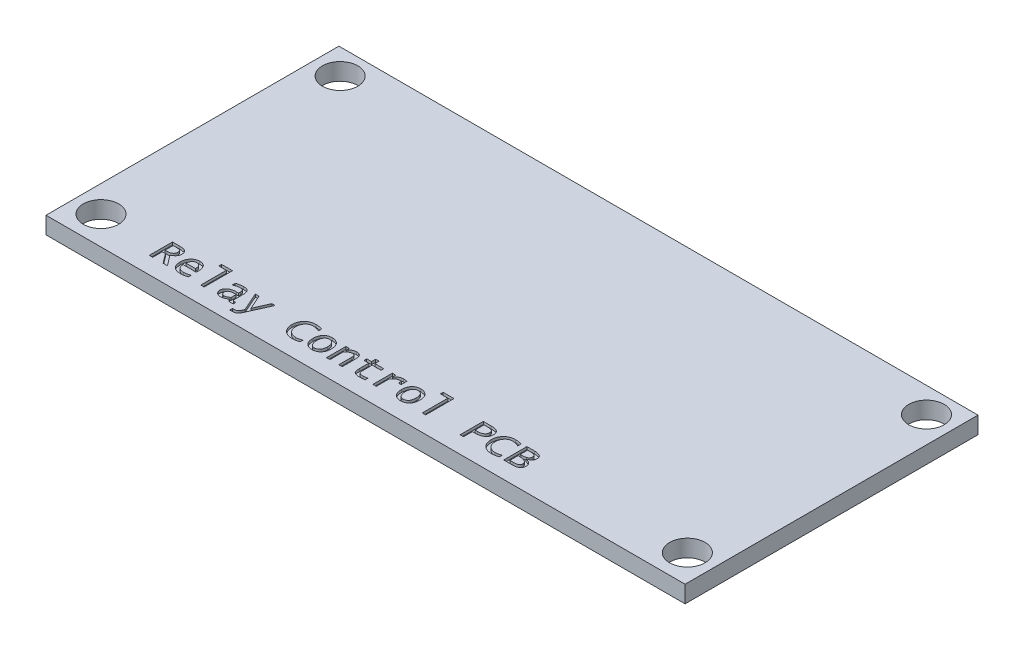
from build123d import *

# Parameters (mm, degrees)
SKETCH1_W           = 60.96
SKETCH1_H           = 27.94
BOSS_EXTRUDE1_DEPTH = 1.6256
SKETCH2_R           = 1.6891
CUT_EXTRUDE1_DEPTH  = 1.6256
CUT_EXTRUDE2_DEPTH  = 0.254


with BuildPart() as part:
    # Sketch1 → Boss-Extrude1 (new body)
    with BuildSketch(Plane(origin=(0, 0, 0), x_dir=(1, 0, 0), z_dir=(0, 1, 0))):
        with Locations((30.48, 13.97)):
            Rectangle(SKETCH1_W, SKETCH1_H)
    extrude(amount=BOSS_EXTRUDE1_DEPTH)

    # Sketch2 → Cut-Extrude1 (cut)
    with BuildSketch(Plane(origin=(0, 1.6256, 0), x_dir=(1, 0, 0), z_dir=(0, 1, 0))):
        with Locations(Location((2.5273, 25.527, 0), (0, 0, 270))):
            Circle(SKETCH2_R)
        with Locations(Location((2.5273, 2.7178, 0), (0, 0, 270))):
            Circle(SKETCH2_R)
        with Locations(Location((58.4581, 25.527, 0), (0, 0, 270))):
            Circle(SKETCH2_R)
        with Locations(Location((58.4581, 2.7178, 0), (0, 0, 270))):
            Circle(SKETCH2_R)
    extrude(amount=-CUT_EXTRUDE1_DEPTH, mode=Mode.SUBTRACT)

    # Sketch3 → Cut-Extrude2 (cut)
    # profile 1 of 15: a face of its own
    with BuildSketch(Plane(origin=(0, 1.6256, 0), x_dir=(1, 0, 0), z_dir=(0, 1, 0))):
        with BuildLine():
            Line((8.241289852, 1.614963424), (8.241289852, 3.825336688))
            Line((8.241289852, 3.825336688), (8.85483096, 3.825336688))
            add(Edge.make_bspline(
                [(8.85483096, 3.825336688), (8.885476334, 3.825151103), (8.944413237, 3.824794188), (9.029104797, 3.821840319), (9.106482902, 3.816623867), (9.176693285, 3.810458116), (9.239612608, 3.80145412), (9.295111287, 3.790061392), (9.343749988, 3.778305924), (9.372649386, 3.766727468), (9.386092549, 3.761341506)],
                knots=[0, 0, 0, 0, 1.367113612, 2.629220428, 3.779705399, 4.826585904, 5.77293059, 6.612770641, 7.354701061, 8, 8, 8, 8], degree=3))
            add(Edge.make_bspline(
                [(9.386092549, 3.761341506), (9.411338501, 3.749837185), (9.460154569, 3.727592205), (9.525477751, 3.683939787), (9.580197997, 3.633462183), (9.626775361, 3.577850331), (9.661183624, 3.514217357), (9.686441123, 3.444802295), (9.701198316, 3.368844169), (9.70307162, 3.316148348), (9.704036865, 3.288996116)],
                knots=[0, 0, 0, 0, 1.093414185, 2.114247111, 3.083486436, 4.023487964, 4.962325756, 5.921685605, 6.929120529, 8, 8, 8, 8], degree=3))
            add(Edge.make_bspline(
                [(9.704036865, 3.288996116), (9.703862196, 3.270015211), (9.703519835, 3.232811728), (9.697348438, 3.178252142), (9.689309719, 3.125804467), (9.676167812, 3.076062448), (9.660854743, 3.028376856), (9.640499601, 2.983707533), (9.618034376, 2.940610952), (9.590492191, 2.900435705), (9.559906016, 2.861140582), (9.523896886, 2.82373871), (9.483679233, 2.786418245), (9.438313646, 2.750088816), (9.388611626, 2.71395262), (9.333874127, 2.67893276), (9.27465449, 2.644353553), (9.232815904, 2.622940787), (9.211375545, 2.611967725)],
                knots=[0, 0, 0, 0, 1.020587864, 2.000401129, 2.951334389, 3.872617743, 4.765590747, 5.642388336, 6.510435801, 7.377000364, 8.259034584, 9.186914164, 10.166727429, 11.209513324, 12.311867936, 13.471627981, 14.704325106, 16, 16, 16, 16], degree=3))
            Line((9.211375545, 2.611967725), (9.965604473, 1.614963424))
            Line((9.965604473, 1.614963424), (9.557762164, 1.614963424))
            Line((9.557762164, 1.614963424), (8.869052112, 2.525117121))
            Line((8.869052112, 2.525117121), (8.566344744, 2.525117121))
            Line((8.566344744, 2.525117121), (8.566344744, 1.614963424))
            Line((8.566344744, 1.614963424), (8.241289852, 1.614963424))
        make_face()
        with BuildLine():
            Line((8.566344744, 2.785161034), (8.747156527, 2.785161034))
            add(Edge.make_bspline(
                [(8.747156527, 2.785161034), (8.769517546, 2.785566587), (8.813294528, 2.786360552), (8.877056054, 2.792086562), (8.937629555, 2.800804064), (8.994153947, 2.814858102), (9.047552949, 2.831275676), (9.096895089, 2.852338759), (9.143039203, 2.876598844), (9.185007773, 2.905182253), (9.223166286, 2.93624288), (9.25610619, 2.970825041), (9.284138922, 3.00792581), (9.307196779, 3.047597826), (9.324577925, 3.09006253), (9.337359847, 3.134995847), (9.345053818, 3.182751267), (9.345997481, 3.215492221), (9.346476484, 3.23211151)],
                knots=[0, 0, 0, 0, 1.276996505, 2.500022648, 3.654255475, 4.768296067, 5.823365809, 6.841681044, 7.82799832, 8.796184009, 9.737138299, 10.633094166, 11.516913919, 12.387677223, 13.246057197, 14.130670065, 15.051129245, 16, 16, 16, 16], degree=3))
            add(Edge.make_bspline(
                [(9.346476484, 3.23211151), (9.346063532, 3.247530942), (9.345271005, 3.277123538), (9.339915616, 3.31960311), (9.329949719, 3.358145045), (9.317346122, 3.393357682), (9.299377721, 3.424287348), (9.278773097, 3.452139799), (9.253518443, 3.475666452), (9.224068902, 3.495368359), (9.189833817, 3.512435003), (9.149412584, 3.526201083), (9.102897189, 3.538350683), (9.049974167, 3.548461366), (8.990569963, 3.55573425), (8.92483426, 3.56124215), (8.85284052, 3.564908554), (8.802691524, 3.565161332), (8.776614627, 3.565292774)],
                knots=[0, 0, 0, 0, 0.972380494, 1.866168869, 2.692100406, 3.479246527, 4.215447888, 4.939238499, 5.656703529, 6.379154588, 7.1668796, 8.061623728, 9.066283506, 10.196846312, 11.456066542, 12.838163819, 14.355881806, 16, 16, 16, 16], degree=3))
            Line((8.776614627, 3.565292774), (8.566344744, 3.565292774))
            Line((8.566344744, 3.565292774), (8.566344744, 2.785161034))
        make_face(mode=Mode.SUBTRACT)
    # profile 2 of 15: a face of its own
    with BuildSketch(Plane(origin=(0, 1.6256, 0), x_dir=(1, 0, 0), z_dir=(0, 1, 0))):
        with BuildLine():
            add(Edge.make_bspline(
                [(11.88190464, 1.701814028), (11.853353113, 1.692314371), (11.797041108, 1.673578256), (11.712729382, 1.649118691), (11.629975414, 1.628917979), (11.549177206, 1.612118397), (11.470279036, 1.598608964), (11.393122768, 1.589686247), (11.317721467, 1.583761187), (11.268035599, 1.58288903), (11.243476516, 1.582457935)],
                knots=[0, 0, 0, 0, 1.106937951, 2.18320703, 3.228556918, 4.239975729, 5.218864236, 6.172194916, 7.096539541, 8, 8, 8, 8], degree=3))
            add(Edge.make_bspline(
                [(11.243476516, 1.582457935), (11.20501839, 1.583284852), (11.130136114, 1.584894951), (11.021070644, 1.596024037), (10.918784995, 1.614859844), (10.823644202, 1.642854464), (10.734849732, 1.676705001), (10.653474564, 1.719958898), (10.578792392, 1.770424392), (10.511055684, 1.828439915), (10.450597879, 1.893711944), (10.398946066, 1.966437545), (10.354003514, 2.045055047), (10.318813053, 2.131146964), (10.29088382, 2.22350306), (10.270494597, 2.322390818), (10.258981657, 2.428003438), (10.257428354, 2.500540857), (10.256630181, 2.537814577)],
                knots=[0, 0, 0, 0, 1.179111467, 2.295861945, 3.357756168, 4.363169365, 5.332947048, 6.266436329, 7.182147119, 8.091479248, 8.995208024, 9.902804883, 10.820984298, 11.765764665, 12.747774982, 13.776032362, 14.857202978, 16, 16, 16, 16], degree=3))
            add(Edge.make_bspline(
                [(10.256630181, 2.537814577), (10.257474376, 2.573225538), (10.259130691, 2.642702033), (10.270243148, 2.744518292), (10.289453308, 2.841620601), (10.317069874, 2.933633507), (10.351524634, 3.021005844), (10.393921092, 3.103451574), (10.444579349, 3.180815471), (10.501955086, 3.253197657), (10.565964418, 3.318277552), (10.633764226, 3.376520918), (10.707223094, 3.423978008), (10.783683944, 3.464504842), (10.865291305, 3.494665902), (10.950561996, 3.517382238), (11.040451182, 3.529988309), (11.101566815, 3.531841556), (11.132754694, 3.532787285)],
                knots=[0, 0, 0, 0, 1.144924092, 2.24634722, 3.307023249, 4.340990177, 5.348357882, 6.339910119, 7.332896818, 8.333998253, 9.321113179, 10.280642896, 11.217417477, 12.142912282, 13.073202805, 14.023869222, 14.991561987, 16, 16, 16, 16], degree=3))
            add(Edge.make_bspline(
                [(11.132754694, 3.532787285), (11.163773086, 3.532193598), (11.223993414, 3.531040991), (11.311058494, 3.519627678), (11.391899876, 3.501474594), (11.466589517, 3.476316544), (11.534856978, 3.443009092), (11.596701942, 3.40223568), (11.652058095, 3.35392917), (11.701305759, 3.298538311), (11.744379129, 3.235165252), (11.781121275, 3.163699498), (11.812852891, 3.084525627), (11.837792759, 2.99692299), (11.858139314, 2.901602689), (11.872151306, 2.797873112), (11.880005696, 2.686244048), (11.881258375, 2.609102217), (11.88190464, 2.56930427)],
                knots=[0, 0, 0, 0, 1.062643871, 2.063058638, 3.003358825, 3.898834045, 4.757807989, 5.599498343, 6.430297586, 7.268761563, 8.133030449, 9.049191006, 10.017869939, 11.051653124, 12.166951628, 13.35602215, 14.635955523, 16, 16, 16, 16], degree=3))
            Line((11.88190464, 2.56930427), (11.88190464, 2.460106142))
            Line((11.88190464, 2.460106142), (10.614190562, 2.460106142))
            add(Edge.make_bspline(
                [(10.614190562, 2.460106142), (10.616193485, 2.435177158), (10.620094053, 2.386629514), (10.631880046, 2.316504323), (10.647922115, 2.250974931), (10.669247506, 2.190434222), (10.695275263, 2.13462839), (10.725706834, 2.083579242), (10.761074529, 2.037307002), (10.801294467, 1.996218724), (10.846020193, 1.959645074), (10.895449701, 1.928109495), (10.949891569, 1.901648334), (11.008894316, 1.879767614), (11.072607566, 1.863334962), (11.140811711, 1.850922077), (11.213707434, 1.844041789), (11.263948201, 1.843023628), (11.289695259, 1.842501848)],
                knots=[0, 0, 0, 0, 1.158383093, 2.255878882, 3.290898553, 4.280849978, 5.224885718, 6.139722503, 7.029356833, 7.916948214, 8.797858555, 9.700949034, 10.627150686, 11.597640165, 12.611818582, 13.672009313, 14.806966626, 16, 16, 16, 16], degree=3))
            add(Edge.make_bspline(
                [(11.289695259, 1.842501848), (11.312394203, 1.842907266), (11.358547438, 1.843731592), (11.42857162, 1.850118473), (11.50028024, 1.860266234), (11.573483982, 1.874621454), (11.648467331, 1.892861027), (11.724861808, 1.916056), (11.803296165, 1.94218964), (11.855411141, 1.962636969), (11.88190464, 1.973031703)],
                knots=[0, 0, 0, 0, 0.892829391, 1.815369226, 2.763820351, 3.740813249, 4.748754968, 5.798112898, 6.88063477, 8, 8, 8, 8], degree=3))
            Line((11.88190464, 1.973031703), (11.88190464, 1.701814028))
        make_face()
        with BuildLine():
            Line((10.624348527, 2.720150056), (11.524344259, 2.720150056))
            Line((11.524344259, 2.720150056), (11.524344259, 2.768400391))
            add(Edge.make_bspline(
                [(11.524344259, 2.768400391), (11.524118105, 2.788729369), (11.523678223, 2.828270278), (11.518401263, 2.885416535), (11.510565461, 2.938792098), (11.498682754, 2.988126658), (11.484441627, 3.033933155), (11.465772513, 3.075439231), (11.444587507, 3.113192825), (11.420091081, 3.147137767), (11.39195126, 3.17691727), (11.3600883, 3.202301214), (11.325465496, 3.224357149), (11.287423996, 3.242265653), (11.245978193, 3.256003514), (11.201135344, 3.265304682), (11.153252662, 3.271704188), (11.120248833, 3.272390732), (11.103296594, 3.272743372)],
                knots=[0, 0, 0, 0, 1.29732314, 2.523360331, 3.660579791, 4.737989141, 5.759926536, 6.717913547, 7.63751686, 8.519516399, 9.383384998, 10.244205955, 11.113734908, 11.998445146, 12.92121842, 13.894207024, 14.918370803, 16, 16, 16, 16], degree=3))
            add(Edge.make_bspline(
                [(11.103296594, 3.272743372), (11.086841716, 3.272465974), (11.0544463, 3.271919849), (11.007239375, 3.264259461), (10.962056446, 3.253575449), (10.919736412, 3.23678346), (10.879354982, 3.216629647), (10.841336446, 3.191571008), (10.806444636, 3.161154546), (10.773319744, 3.127280527), (10.743152437, 3.089088321), (10.717181377, 3.046554826), (10.692768878, 3.001281526), (10.672741456, 2.951978653), (10.656058614, 2.899061831), (10.641701914, 2.842841701), (10.631146243, 2.782711129), (10.626651275, 2.741342812), (10.624348527, 2.720150056)],
                knots=[0, 0, 0, 0, 0.971093896, 1.911833578, 2.819168626, 3.708966016, 4.594706045, 5.482477073, 6.39058371, 7.324330932, 8.278849472, 9.258559982, 10.265318396, 11.314847487, 12.396720664, 13.541809176, 14.740682675, 16, 16, 16, 16], degree=3))
        make_face(mode=Mode.SUBTRACT)
    # profile 3 of 15: a face of its own
    with BuildSketch(Plane(origin=(0, 1.6256, 0), x_dir=(1, 0, 0), z_dir=(0, 1, 0))):
        Polygon((13.149618718, 1.614963424), (13.149618718, 4.052875112), (12.434497956, 4.052875112), (12.434497956, 4.312919025), (13.474673609, 4.312919025), (13.474673609, 1.614963424), align=None)
    # profile 4 of 15: a face of its own
    with BuildSketch(Plane(origin=(0, 1.6256, 0), x_dir=(1, 0, 0), z_dir=(0, 1, 0))):
        with BuildLine():
            add(Edge.make_bspline(
                [(15.673365213, 1.839454459), (15.6482865, 1.818888937), (15.599448825, 1.778840143), (15.522628447, 1.727148247), (15.446537925, 1.682457377), (15.369958022, 1.646378317), (15.293871975, 1.617410223), (15.217357703, 1.597719388), (15.141186645, 1.584831242), (15.090178868, 1.583244306), (15.064903088, 1.582457935)],
                knots=[0, 0, 0, 0, 1.153890534, 2.247058269, 3.292071886, 4.29219234, 5.257104076, 6.185296689, 7.100763748, 8, 8, 8, 8], degree=3))
            add(Edge.make_bspline(
                [(15.064903088, 1.582457935), (15.044234533, 1.583025956), (15.003639243, 1.584141611), (14.944094654, 1.590530815), (14.887358455, 1.60235879), (14.833542111, 1.618653121), (14.782147521, 1.638907109), (14.733876163, 1.664415058), (14.688370729, 1.694650522), (14.646007114, 1.728966492), (14.607399384, 1.766650069), (14.574486334, 1.807794495), (14.545264958, 1.850448431), (14.522886246, 1.896596174), (14.504009066, 1.944464462), (14.491670781, 1.995051284), (14.483678038, 2.047944264), (14.482795467, 2.084061335), (14.482343774, 2.102545762)],
                knots=[0, 0, 0, 0, 1.135034291, 2.229330773, 3.283077622, 4.312349151, 5.313532734, 6.311474483, 7.304076705, 8.308706713, 9.301265407, 10.259450024, 11.197907141, 12.133274565, 13.068965271, 14.018134357, 14.985697108, 16, 16, 16, 16], degree=3))
            add(Edge.make_bspline(
                [(14.482343774, 2.102545762), (14.483139361, 2.126462083), (14.484695312, 2.173235852), (14.496504571, 2.24179118), (14.517066237, 2.306524506), (14.545079802, 2.367836153), (14.580991981, 2.425611786), (14.625926481, 2.478858905), (14.677744974, 2.529602216), (14.73808435, 2.575299385), (14.804046031, 2.617528269), (14.876337369, 2.653328875), (14.953062073, 2.684699909), (15.035371712, 2.709114171), (15.122304448, 2.729313087), (15.214595179, 2.742383032), (15.311723712, 2.751595445), (15.378252809, 2.75229664), (15.412305503, 2.752655545)],
                knots=[0, 0, 0, 0, 0.905207686, 1.770338063, 2.623778729, 3.469870763, 4.316423955, 5.190436419, 6.101525076, 7.056642134, 8.050647555, 9.062512752, 10.106353745, 11.185035099, 12.309221938, 13.48219702, 14.711271009, 16, 16, 16, 16], degree=3))
            Line((15.412305503, 2.752655545), (15.620035895, 2.752655545))
            Line((15.620035895, 2.752655545), (15.620035895, 2.910611906))
            add(Edge.make_bspline(
                [(15.620035895, 2.910611906), (15.619732243, 2.926367179), (15.619146729, 2.956747138), (15.615005093, 3.000515355), (15.608712624, 3.04085983), (15.598981147, 3.077546841), (15.586883649, 3.11078322), (15.572064285, 3.140715529), (15.554447862, 3.167141284), (15.533682121, 3.190034604), (15.509694436, 3.209521155), (15.482817503, 3.2270004), (15.451901806, 3.241059931), (15.417698662, 3.252734821), (15.379775562, 3.261799758), (15.338353652, 3.2683773), (15.29334, 3.271662396), (15.262310441, 3.272374284), (15.246222769, 3.272743372)],
                knots=[0, 0, 0, 0, 1.248532718, 2.407471645, 3.481758227, 4.480934039, 5.410664349, 6.280774303, 7.12184432, 7.919742115, 8.720343129, 9.565257569, 10.453694103, 11.404203611, 12.426095927, 13.540121796, 14.724644734, 16, 16, 16, 16], degree=3))
            add(Edge.make_bspline(
                [(15.246222769, 3.272743372), (15.221825757, 3.272244372), (15.1729145, 3.271243974), (15.099053926, 3.263371215), (15.024853526, 3.249959439), (14.949585698, 3.232308882), (14.87426972, 3.208700542), (14.797915131, 3.180579615), (14.721010116, 3.147334898), (14.670463217, 3.121343719), (14.64487122, 3.108184333)],
                knots=[0, 0, 0, 0, 0.929836159, 1.864140347, 2.82750036, 3.802654558, 4.808977315, 5.833936312, 6.903317557, 8, 8, 8, 8], degree=3))
            Line((14.64487122, 3.108184333), (14.64487122, 3.401241634))
            add(Edge.make_bspline(
                [(14.64487122, 3.401241634), (14.674063836, 3.411857924), (14.731547663, 3.432762696), (14.818210439, 3.458705236), (14.90301968, 3.482181326), (14.986916056, 3.499992378), (15.06912957, 3.51522123), (15.150208586, 3.525172004), (15.229865358, 3.531586161), (15.282610191, 3.532389839), (15.308694256, 3.532787285)],
                knots=[0, 0, 0, 0, 1.095658522, 2.157485397, 3.190532041, 4.199239102, 5.182224591, 6.139393651, 7.079868589, 8, 8, 8, 8], degree=3))
            add(Edge.make_bspline(
                [(15.308694256, 3.532787285), (15.336641525, 3.532459528), (15.390589271, 3.531826844), (15.468326031, 3.525268898), (15.539595825, 3.51415232), (15.604620794, 3.499178974), (15.663154919, 3.479440216), (15.715607199, 3.455582174), (15.761818417, 3.42723213), (15.801596888, 3.393441334), (15.836521585, 3.354846783), (15.865213122, 3.309312101), (15.890390032, 3.258172085), (15.91038987, 3.200455382), (15.926155459, 3.136527395), (15.936819, 3.066309127), (15.944356473, 2.989837606), (15.944839651, 2.936704598), (15.945090787, 2.909088212)],
                knots=[0, 0, 0, 0, 1.288059159, 2.486392846, 3.592378245, 4.610779344, 5.55845866, 6.434921453, 7.262158836, 8.04855768, 8.833406052, 9.651649244, 10.520715006, 11.456201581, 12.461268821, 13.551837875, 14.727544453, 16, 16, 16, 16], degree=3))
            Line((15.945090787, 2.909088212), (15.945090787, 2.131495963))
            add(Edge.make_bspline(
                [(15.945090787, 2.131495963), (15.945519135, 2.10574551), (15.946301754, 2.058697814), (15.953107322, 1.994508405), (15.964040397, 1.94345835), (15.979814433, 1.903294495), (16.00520026, 1.874670489), (16.038490667, 1.8555933), (16.079589396, 1.843838194), (16.109730435, 1.842968488), (16.12590257, 1.842501848)],
                knots=[0, 0, 0, 0, 1.561127975, 2.852278997, 3.905582773, 4.723763991, 5.436425983, 6.177572276, 7.022178762, 8, 8, 8, 8], degree=3))
            add(Edge.make_bspline(
                [(16.12590257, 1.842501848), (16.132517365, 1.842711195), (16.147684134, 1.843191197), (16.172833403, 1.847420639), (16.203600454, 1.852136151), (16.225646869, 1.857080596), (16.237640189, 1.859770389)],
                knots=[0, 0, 0, 0, 0.700679122, 1.606555997, 2.697958932, 4, 4, 4, 4], degree=3))
            Line((16.237640189, 1.859770389), (16.270145678, 1.641882032))
            add(Edge.make_bspline(
                [(16.270145678, 1.641882032), (16.243649938, 1.632964297), (16.194376964, 1.616380374), (16.124782276, 1.597446546), (16.0652237, 1.585037562), (16.028599869, 1.583258033), (16.012133358, 1.582457935)],
                knots=[0, 0, 0, 0, 1.261837553, 2.346584317, 3.256604634, 4, 4, 4, 4], degree=3))
            add(Edge.make_bspline(
                [(16.012133358, 1.582457935), (15.992086653, 1.583179865), (15.953122091, 1.584583073), (15.897426703, 1.597087272), (15.846340298, 1.616933978), (15.800878585, 1.645767942), (15.760444796, 1.682529768), (15.726053508, 1.727598957), (15.695268915, 1.77983152), (15.68087081, 1.81902386), (15.673365213, 1.839454459)],
                knots=[0, 0, 0, 0, 1.048318431, 2.037605065, 2.972505624, 3.904544578, 4.839445137, 5.818192706, 6.862644383, 8, 8, 8, 8], degree=3))
        make_face()
        with BuildLine():
            Line((15.620035895, 2.05023224), (15.620035895, 2.525117121))
            Line((15.620035895, 2.525117121), (15.520995732, 2.525117121))
            add(Edge.make_bspline(
                [(15.520995732, 2.525117121), (15.493560273, 2.524863762), (15.440342238, 2.524372309), (15.36311032, 2.519480072), (15.290970311, 2.512969768), (15.224414927, 2.502032313), (15.16308497, 2.489103225), (15.107043274, 2.472869301), (15.056093154, 2.453822829), (15.010760956, 2.431385348), (14.970350642, 2.406535882), (14.93585932, 2.37783585), (14.905803977, 2.346868463), (14.881776152, 2.312275939), (14.862620063, 2.274951543), (14.849623106, 2.23426613), (14.841136766, 2.190934748), (14.84032064, 2.160995659), (14.839904155, 2.145717114)],
                knots=[0, 0, 0, 0, 1.50625563, 2.92176505, 4.248237091, 5.481598122, 6.623035994, 7.688018134, 8.682502909, 9.605460173, 10.461778299, 11.280695653, 12.063186274, 12.824006038, 13.584825801, 14.35798353, 15.16204461, 16, 16, 16, 16], degree=3))
            add(Edge.make_bspline(
                [(14.839904155, 2.145717114), (14.84093115, 2.123940761), (14.842912375, 2.081930975), (14.859484985, 2.022093479), (14.887531617, 1.969200547), (14.925808782, 1.923612851), (14.973654483, 1.887293317), (15.029322555, 1.861046765), (15.09212015, 1.84499857), (15.136418272, 1.843354008), (15.159372165, 1.842501848)],
                knots=[0, 0, 0, 0, 1.052589828, 2.030600508, 2.976191915, 3.92977149, 4.888406153, 5.859563425, 6.890893128, 8, 8, 8, 8], degree=3))
            add(Edge.make_bspline(
                [(15.159372165, 1.842501848), (15.177706966, 1.843011685), (15.214826289, 1.844043864), (15.270579124, 1.85512381), (15.327021016, 1.871329031), (15.384478581, 1.893835268), (15.442228364, 1.923765474), (15.501348311, 1.95944257), (15.561384951, 2.001556451), (15.600110772, 2.033695915), (15.620035895, 2.05023224)],
                knots=[0, 0, 0, 0, 0.852214443, 1.725332208, 2.635486976, 3.583556618, 4.591294557, 5.65873827, 6.795379228, 8, 8, 8, 8], degree=3))
        make_face(mode=Mode.SUBTRACT)
    # profile 5 of 15: a face of its own
    with BuildSketch(Plane(origin=(0, 1.6256, 0), x_dir=(1, 0, 0), z_dir=(0, 1, 0))):
        with BuildLine():
            Line((16.59520057, 0.932348151), (16.59520057, 1.192392065))
            Line((16.59520057, 1.192392065), (16.733348899, 1.192392065))
            add(Edge.make_bspline(
                [(16.733348899, 1.192392065), (16.748925581, 1.192636528), (16.778915236, 1.193107192), (16.822365767, 1.195306705), (16.862342896, 1.200553743), (16.89911349, 1.207175724), (16.932943644, 1.21491058), (16.963211417, 1.225759402), (16.990512749, 1.237674956), (17.014731291, 1.252612693), (17.037746721, 1.270271903), (17.060050906, 1.29256786), (17.082774756, 1.318894824), (17.105677869, 1.349726045), (17.128926516, 1.384632952), (17.15226049, 1.424077543), (17.176248819, 1.467649082), (17.191281198, 1.498748868), (17.199091611, 1.514907465)],
                knots=[0, 0, 0, 0, 1.215822254, 2.340812267, 3.392915948, 4.359586048, 5.256858456, 6.096751702, 6.865455452, 7.576961609, 8.311643621, 9.12449773, 10.033080132, 11.024005455, 12.119673954, 13.304740363, 14.59961686, 16, 16, 16, 16], degree=3))
            Line((17.199091611, 1.514907465), (17.283402724, 1.690640266))
            Line((17.283402724, 1.690640266), (16.497684103, 3.467776307))
            Line((16.497684103, 3.467776307), (16.85321289, 3.467776307))
            Line((16.85321289, 3.467776307), (17.461167118, 2.092387796))
            Line((17.461167118, 2.092387796), (18.077755615, 3.467776307))
            Line((18.077755615, 3.467776307), (18.383002475, 3.467776307))
            Line((18.383002475, 3.467776307), (17.440343289, 1.370664357))
            add(Edge.make_bspline(
                [(17.440343289, 1.370664357), (17.431046573, 1.350934859), (17.412965669, 1.312563547), (17.38350254, 1.258016046), (17.352630885, 1.208318523), (17.320417351, 1.163032598), (17.286653716, 1.122576398), (17.251216175, 1.08668859), (17.214953368, 1.055063325), (17.176519501, 1.028267144), (17.13582247, 1.004682229), (17.09081506, 0.986021891), (17.042372367, 0.968674694), (16.989461466, 0.956141212), (16.932914068, 0.945200682), (16.87216623, 0.937776599), (16.807405316, 0.933168001), (16.762815279, 0.932626042), (16.739951577, 0.932348151)],
                knots=[0, 0, 0, 0, 1.175621874, 2.286431924, 3.33997403, 4.327736134, 5.280120566, 6.177196756, 7.044386362, 7.869844285, 8.699630067, 9.574470369, 10.492337385, 11.470736604, 12.501781695, 13.596464551, 14.767578506, 16, 16, 16, 16], degree=3))
            Line((16.739951577, 0.932348151), (16.59520057, 0.932348151))
        make_face()
    # profile 6 of 15: a face of its own
    with BuildSketch(Plane(origin=(0, 1.6256, 0), x_dir=(1, 0, 0), z_dir=(0, 1, 0))):
        with BuildLine():
            add(Edge.make_bspline(
                [(22.576210578, 1.664737454), (22.548003193, 1.655549582), (22.49221892, 1.637379207), (22.408309735, 1.614162804), (22.325869598, 1.594201073), (22.244455968, 1.578538646), (22.164533164, 1.565761258), (22.085596553, 1.556396515), (22.007936378, 1.551436341), (21.956580621, 1.550443507), (21.931179777, 1.549952446)],
                knots=[0, 0, 0, 0, 1.081965916, 2.139747483, 3.174733324, 4.175094905, 5.162931694, 6.126536825, 7.073374689, 8, 8, 8, 8], degree=3))
            add(Edge.make_bspline(
                [(21.931179777, 1.549952446), (21.888131986, 1.550910224), (21.803976837, 1.552782608), (21.680969458, 1.567934846), (21.564197534, 1.591864622), (21.454002449, 1.6266176), (21.35006328, 1.670911143), (21.252706195, 1.725470125), (21.161784534, 1.789993987), (21.077662435, 1.863286831), (21.002125781, 1.944908463), (20.936125631, 2.033463079), (20.879839776, 2.128110828), (20.834893768, 2.229433772), (20.798656804, 2.336219536), (20.774410942, 2.449754794), (20.758629279, 2.569198354), (20.756823465, 2.651023656), (20.755903184, 2.692723549)],
                knots=[0, 0, 0, 0, 1.118931216, 2.187425234, 3.217350199, 4.21414867, 5.186325687, 6.15001506, 7.109977582, 8.080189445, 9.045807082, 9.995725862, 10.946928827, 11.902491192, 12.872703055, 13.87343005, 14.916255286, 16, 16, 16, 16], degree=3))
            add(Edge.make_bspline(
                [(20.755903184, 2.692723549), (20.756825193, 2.735097831), (20.758631193, 2.818099154), (20.77432977, 2.939263815), (20.799015289, 3.054448105), (20.833984423, 3.163456552), (20.879440652, 3.266296023), (20.935171055, 3.362676372), (21.000508605, 3.453206073), (21.075561945, 3.536635719), (21.158495639, 3.61217239), (21.248376259, 3.678072155), (21.344495934, 3.733965937), (21.447085171, 3.778868022), (21.555399563, 3.81509298), (21.670120854, 3.839227701), (21.790721231, 3.85517719), (21.873225615, 3.856940213), (21.915434931, 3.857842177)],
                knots=[0, 0, 0, 0, 1.0995232, 2.153709225, 3.165665306, 4.153781185, 5.119809112, 6.078613098, 7.038534319, 8.012595404, 8.986339211, 9.945294251, 10.900293905, 11.866321831, 12.847445323, 13.859401405, 14.904867853, 16, 16, 16, 16], degree=3))
            add(Edge.make_bspline(
                [(21.915434931, 3.857842177), (21.965263751, 3.856442076), (22.066945799, 3.85358499), (22.221969429, 3.833844409), (22.38209864, 3.802142604), (22.489049455, 3.771443135), (22.543705089, 3.755754625)],
                knots=[0, 0, 0, 0, 0.936097553, 1.910226207, 2.932051975, 4, 4, 4, 4], degree=3))
            Line((22.543705089, 3.755754625), (22.543705089, 3.441873495))
            add(Edge.make_bspline(
                [(22.543705089, 3.441873495), (22.51555626, 3.454364932), (22.460124742, 3.478963443), (22.37617838, 3.510086207), (22.293973424, 3.537364439), (22.213022206, 3.559076325), (22.133768264, 3.576621969), (22.05575139, 3.588864894), (21.979062038, 3.596148216), (21.928316509, 3.597252624), (21.903245373, 3.597798264)],
                knots=[0, 0, 0, 0, 1.112675182, 2.191113334, 3.233975947, 4.241734523, 5.218597299, 6.166145841, 7.093973251, 8, 8, 8, 8], degree=3))
            add(Edge.make_bspline(
                [(21.903245373, 3.597798264), (21.875102353, 3.597003974), (21.81992166, 3.595446591), (21.739002017, 3.583592284), (21.661951704, 3.563630237), (21.588342036, 3.536335004), (21.518962464, 3.500416671), (21.453357097, 3.456870097), (21.391811896, 3.4053246), (21.334737542, 3.346401305), (21.282513038, 3.281860085), (21.237270845, 3.211971384), (21.198814086, 3.13787748), (21.167988525, 3.059285013), (21.143531213, 2.976530582), (21.125648438, 2.889587032), (21.115566653, 2.798097673), (21.114174695, 2.735749855), (21.113463565, 2.703897311)],
                knots=[0, 0, 0, 0, 1.011028754, 1.982348333, 2.931097292, 3.866687365, 4.797200433, 5.731939655, 6.690777018, 7.675943026, 8.675430251, 9.669291956, 10.662408638, 11.670082472, 12.697955605, 13.759796357, 14.855514333, 16, 16, 16, 16], degree=3))
            add(Edge.make_bspline(
                [(21.113463565, 2.703897311), (21.114262956, 2.671864911), (21.115833366, 2.608936965), (21.127624404, 2.516738885), (21.147313336, 2.429125109), (21.17514776, 2.34604003), (21.209873407, 2.26709863), (21.253468042, 2.192893329), (21.305282122, 2.123603325), (21.363719467, 2.058897852), (21.428688744, 2.000427057), (21.499020191, 1.949688884), (21.573482025, 1.905983947), (21.652827246, 1.870983527), (21.73630854, 1.843376581), (21.824497763, 1.824247119), (21.916970865, 1.812336301), (21.980239916, 1.810785638), (22.0124435, 1.809996359)],
                knots=[0, 0, 0, 0, 1.080131531, 2.121928359, 3.128955641, 4.10398994, 5.072751268, 6.032450968, 6.999713538, 7.986051033, 8.96856335, 9.941656347, 10.906286262, 11.87504759, 12.860922218, 13.866702285, 14.914163681, 16, 16, 16, 16], degree=3))
            add(Edge.make_bspline(
                [(22.0124435, 1.809996359), (22.032770053, 1.810451761), (22.074508774, 1.811386886), (22.138450538, 1.817136013), (22.205079409, 1.826821922), (22.274143735, 1.840796311), (22.346044629, 1.858013177), (22.420476729, 1.879577485), (22.497860206, 1.904245324), (22.549706386, 1.923547968), (22.576210578, 1.933415638)],
                knots=[0, 0, 0, 0, 0.840932187, 1.726777439, 2.653885648, 3.62500311, 4.640855233, 5.711624304, 6.830163618, 8, 8, 8, 8], degree=3))
            Line((22.576210578, 1.933415638), (22.576210578, 1.664737454))
        make_face()
    # profile 7 of 15: a face of its own
    with BuildSketch(Plane(origin=(0, 1.6256, 0), x_dir=(1, 0, 0), z_dir=(0, 1, 0))):
        with BuildLine():
            add(Edge.make_bspline(
                [(23.778913678, 1.582457935), (23.745691322, 1.583199899), (23.680706704, 1.58465122), (23.585987942, 1.597100057), (23.496730717, 1.617090211), (23.413047081, 1.645951932), (23.334630417, 1.682267398), (23.261897906, 1.727397988), (23.194918461, 1.78074713), (23.133531466, 1.841644029), (23.078427711, 1.909794839), (23.031337916, 1.984928058), (22.990946164, 2.065689467), (22.957831464, 2.152415624), (22.932543749, 2.245527606), (22.914598711, 2.344596327), (22.903018344, 2.449674524), (22.901859697, 2.52169947), (22.90126547, 2.558638407)],
                knots=[0, 0, 0, 0, 1.072174873, 2.097228592, 3.07839926, 4.020425222, 4.949599149, 5.862686761, 6.776902439, 7.708340278, 8.649017484, 9.599771575, 10.565289158, 11.560066848, 12.591686091, 13.675514101, 14.807856972, 16, 16, 16, 16], degree=3))
            add(Edge.make_bspline(
                [(22.90126547, 2.558638407), (22.901866608, 2.595408141), (22.903041359, 2.667263949), (22.914545796, 2.771837314), (22.932479563, 2.870645363), (22.958541038, 2.962992432), (22.990839625, 3.04991044), (23.031745774, 3.130258486), (23.079632963, 3.204879274), (23.134528686, 3.273090301), (23.195949608, 3.334195985), (23.263525941, 3.387117559), (23.33587573, 3.432935619), (23.414326447, 3.469503451), (23.497972741, 3.497962631), (23.586988131, 3.518181189), (23.68121569, 3.530585353), (23.745861416, 3.532042348), (23.778913678, 3.532787285)],
                knots=[0, 0, 0, 0, 1.188895986, 2.323353253, 3.398437033, 4.433446693, 5.423016482, 6.392798232, 7.343657726, 8.286091435, 9.219268525, 10.139486328, 11.05717527, 11.983126573, 12.932092048, 13.909757331, 14.931294437, 16, 16, 16, 16], degree=3))
            add(Edge.make_bspline(
                [(23.778913678, 3.532787285), (23.812134442, 3.5320391), (23.877115946, 3.530575613), (23.971692996, 3.518235113), (24.060870382, 3.497958873), (24.144515046, 3.469502705), (24.22297389, 3.43294202), (24.295293137, 3.387092866), (24.362889486, 3.334363215), (24.423805, 3.272911795), (24.478674397, 3.204879611), (24.526741099, 3.130408821), (24.566692264, 3.049638918), (24.600137674, 2.963224187), (24.625116811, 2.870526775), (24.643350269, 2.771858581), (24.654767452, 2.667258209), (24.65595447, 2.595406198), (24.656561885, 2.558638407)],
                knots=[0, 0, 0, 0, 1.07383805, 2.100481851, 3.077838711, 4.026504818, 4.952164011, 5.869563452, 6.789490955, 7.718494777, 8.660631178, 9.611190705, 10.578206016, 11.569415558, 12.602635067, 13.677379692, 14.811479073, 16, 16, 16, 16], degree=3))
            add(Edge.make_bspline(
                [(24.656561885, 2.558638407), (24.655967586, 2.521699514), (24.654808797, 2.449674655), (24.643229439, 2.344595843), (24.625280821, 2.245529305), (24.600005598, 2.152409701), (24.566846775, 2.065710466), (24.526572505, 1.984771158), (24.478845701, 1.909919334), (24.423789433, 1.841829095), (24.362872103, 1.780407602), (24.295447656, 1.727563899), (24.22281042, 1.682397185), (24.144537743, 1.645706048), (24.060864044, 1.617296531), (23.971694802, 1.597007206), (23.87711546, 1.584670387), (23.812134277, 1.583206383), (23.778913678, 1.582457935)],
                knots=[0, 0, 0, 0, 1.192273997, 2.324741268, 3.408688348, 4.440420926, 5.435307903, 6.400931558, 7.354723814, 8.295504364, 9.223171233, 10.141774846, 11.05496277, 11.979289825, 12.926590682, 13.902541005, 14.927707337, 16, 16, 16, 16], degree=3))
        make_face()
        with BuildLine():
            add(Edge.make_bspline(
                [(23.778913678, 1.842501848), (23.798753139, 1.843099291), (23.837441752, 1.844264353), (23.89388619, 1.853008365), (23.947117141, 1.867738756), (23.996962531, 1.88853836), (24.043384797, 1.915349082), (24.086322628, 1.948186456), (24.125978497, 1.986954531), (24.162136081, 2.031499632), (24.194585377, 2.08114771), (24.222424865, 2.135947333), (24.246466296, 2.19500532), (24.265488641, 2.258864378), (24.280942415, 2.327209576), (24.291112736, 2.400271531), (24.298096281, 2.477916226), (24.298693753, 2.531195045), (24.299001505, 2.558638407)],
                knots=[0, 0, 0, 0, 0.954404882, 1.861169577, 2.740738495, 3.606159153, 4.452935588, 5.313241398, 6.200435857, 7.11525242, 8.068787685, 9.048888521, 10.068516339, 11.13285666, 12.251524777, 13.437044256, 14.679848308, 16, 16, 16, 16], degree=3))
            add(Edge.make_bspline(
                [(24.299001505, 2.558638407), (24.298692547, 2.585912237), (24.298092839, 2.638852574), (24.291129131, 2.715994988), (24.280868213, 2.78869813), (24.26559465, 2.856752782), (24.246335178, 2.920363996), (24.22257688, 2.979205076), (24.194430164, 3.033678385), (24.162156281, 3.083250134), (24.125967297, 3.127769257), (24.0863471, 3.166591309), (24.043232893, 3.199296867), (23.997122303, 3.226812096), (23.947094964, 3.247468551), (23.89389234, 3.262247368), (23.8374401, 3.270978041), (23.798752579, 3.272144972), (23.778913678, 3.272743372)],
                knots=[0, 0, 0, 0, 1.314904231, 2.552317445, 3.732375766, 4.853513673, 5.912394897, 6.934273843, 7.909284228, 8.864924703, 9.781760993, 10.670914194, 11.533119383, 12.38587919, 13.253210518, 14.134721343, 15.043487988, 16, 16, 16, 16], degree=3))
            add(Edge.make_bspline(
                [(23.778913678, 3.272743372), (23.759074424, 3.272145578), (23.720386215, 3.27097983), (23.663938888, 3.262240713), (23.610718427, 3.247492551), (23.560620646, 3.226668384), (23.514158638, 3.199462061), (23.470984111, 3.16657028), (23.431351236, 3.127774203), (23.395154131, 3.083252464), (23.362928526, 3.033663006), (23.334618195, 2.979322545), (23.311639516, 2.920237235), (23.292184739, 2.856772016), (23.276973046, 2.788692554), (23.266694239, 2.715996587), (23.259735607, 2.638852136), (23.25913518, 2.585912088), (23.258825851, 2.558638407)],
                knots=[0, 0, 0, 0, 0.956272499, 1.864811586, 2.746101678, 3.613215825, 4.472805643, 5.334794933, 6.223725488, 7.140332199, 8.095733379, 9.07049962, 10.089085583, 11.14770166, 12.268558831, 13.448321662, 14.685425025, 16, 16, 16, 16], degree=3))
            add(Edge.make_bspline(
                [(23.258825851, 2.558638407), (23.259133976, 2.531195194), (23.259732174, 2.477916667), (23.2667106, 2.400269919), (23.276898929, 2.327215186), (23.292290677, 2.258845113), (23.311509803, 2.195132631), (23.334768803, 2.135829269), (23.362773381, 2.081163112), (23.395174318, 2.031497293), (23.431340134, 1.986949639), (23.471008219, 1.948207288), (23.514008403, 1.915183829), (23.560778689, 1.888682042), (23.610696594, 1.867714921), (23.663944943, 1.853014975), (23.720384588, 1.844262577), (23.759073872, 1.843098688), (23.778913678, 1.842501848)],
                knots=[0, 0, 0, 0, 1.319819063, 2.562309976, 3.747530748, 4.865917003, 5.92998915, 6.946329654, 7.926183542, 8.879478552, 9.794064616, 10.681035534, 11.54112458, 12.394749464, 13.259952068, 14.139299368, 15.045835592, 16, 16, 16, 16], degree=3))
        make_face(mode=Mode.SUBTRACT)
    # profile 8 of 15: a face of its own
    with BuildSketch(Plane(origin=(0, 1.6256, 0), x_dir=(1, 0, 0), z_dir=(0, 1, 0))):
        with BuildLine():
            Line((25.144144223, 1.614963424), (25.144144223, 3.467776307))
            Line((25.144144223, 3.467776307), (25.469199115, 3.467776307))
            Line((25.469199115, 3.467776307), (25.469199115, 3.142213517))
            add(Edge.make_bspline(
                [(25.469199115, 3.142213517), (25.488811717, 3.173187259), (25.526892353, 3.233327151), (25.594250575, 3.313051461), (25.666249714, 3.381112118), (25.743853143, 3.436904375), (25.826979457, 3.480095571), (25.915631819, 3.510551217), (26.009480503, 3.529470604), (26.073846713, 3.531668485), (26.106611442, 3.532787285)],
                knots=[0, 0, 0, 0, 1.119649931, 2.173958367, 3.180912024, 4.141746267, 5.086201653, 6.033898928, 6.999183433, 8, 8, 8, 8], degree=3))
            add(Edge.make_bspline(
                [(26.106611442, 3.532787285), (26.128126327, 3.532259336), (26.169924151, 3.531233668), (26.230588724, 3.524484818), (26.28690955, 3.511365162), (26.339437359, 3.494574704), (26.387480061, 3.471826499), (26.431888977, 3.444967837), (26.471424631, 3.412034726), (26.50747498, 3.374881359), (26.538407927, 3.332219469), (26.565534529, 3.284857487), (26.589002505, 3.232778953), (26.60688892, 3.17514719), (26.621659239, 3.113238202), (26.63235264, 3.046196791), (26.638268309, 2.97420812), (26.639013356, 2.924505229), (26.639396725, 2.898930246)],
                knots=[0, 0, 0, 0, 1.08963329, 2.116873886, 3.083969068, 4.013869157, 4.903661156, 5.769718859, 6.634715085, 7.501790582, 8.384866448, 9.295115169, 10.26221035, 11.270785745, 12.345853042, 13.483274278, 14.705000517, 16, 16, 16, 16], degree=3))
            Line((26.639396725, 2.898930246), (26.639396725, 1.614963424))
            Line((26.639396725, 1.614963424), (26.314341833, 1.614963424))
            Line((26.314341833, 1.614963424), (26.314341833, 2.80395327))
            add(Edge.make_bspline(
                [(26.314341833, 2.80395327), (26.314229005, 2.821569554), (26.314011771, 2.855487181), (26.310077337, 2.904257394), (26.305361757, 2.949252594), (26.298023877, 2.990264501), (26.287493148, 3.027090813), (26.276146908, 3.060477837), (26.262102483, 3.089880838), (26.245441442, 3.115418613), (26.226511463, 3.137671663), (26.204462264, 3.156515131), (26.17961438, 3.172374756), (26.152168884, 3.185907596), (26.121131284, 3.1949869), (26.087680871, 3.203097348), (26.050988176, 3.206711464), (26.025689899, 3.207385151), (26.012650262, 3.207732393)],
                knots=[0, 0, 0, 0, 1.449150917, 2.790132141, 4.02400036, 5.171643627, 6.212696268, 7.173267496, 8.07052967, 8.885853758, 9.67615562, 10.466457483, 11.26250974, 12.097474506, 12.974278273, 13.917209745, 14.926455424, 16, 16, 16, 16], degree=3))
            add(Edge.make_bspline(
                [(26.012650262, 3.207732393), (25.990881588, 3.206604978), (25.946386669, 3.204300554), (25.879501427, 3.186497665), (25.812352672, 3.157484731), (25.744173098, 3.117962954), (25.676111324, 3.066341119), (25.607052826, 3.003938595), (25.536790738, 2.93072595), (25.492337446, 2.876077515), (25.469199115, 2.847632521)],
                knots=[0, 0, 0, 0, 0.77537057, 1.584848587, 2.450241041, 3.377760666, 4.386871955, 5.489539811, 6.693283263, 8, 8, 8, 8], degree=3))
            Line((25.469199115, 2.847632521), (25.469199115, 1.614963424))
            Line((25.469199115, 1.614963424), (25.144144223, 1.614963424))
        make_face()
    # profile 9 of 15: a face of its own
    with BuildSketch(Plane(origin=(0, 1.6256, 0), x_dir=(1, 0, 0), z_dir=(0, 1, 0))):
        with BuildLine():
            add(Edge.make_bspline(
                [(28.8172645, 1.628168779), (28.775331498, 1.621195258), (28.692541174, 1.607427103), (28.568637656, 1.593417425), (28.446972406, 1.58437521), (28.366435519, 1.583092059), (28.326634773, 1.582457935)],
                knots=[0, 0, 0, 0, 1.03382736, 2.041134665, 3.031942924, 4, 4, 4, 4], degree=3))
            add(Edge.make_bspline(
                [(28.326634773, 1.582457935), (28.293613709, 1.583012989), (28.230211153, 1.584078728), (28.13906432, 1.590252933), (28.056173046, 1.602129207), (27.981210818, 1.617198992), (27.9146626, 1.638038936), (27.856410276, 1.663407778), (27.805673947, 1.692698702), (27.762909401, 1.728039947), (27.726767808, 1.770140958), (27.696514511, 1.819828849), (27.671017763, 1.877602844), (27.650689228, 1.943499073), (27.633829837, 2.017297643), (27.622444579, 2.099532451), (27.616165032, 2.189804775), (27.615109758, 2.25270431), (27.6145614, 2.285389138)],
                knots=[0, 0, 0, 0, 1.338818366, 2.57061693, 3.700446535, 4.731568671, 5.667144241, 6.521530263, 7.303123571, 8.034269379, 8.759366006, 9.542193892, 10.384026984, 11.313059192, 12.33371188, 13.449950821, 14.674904035, 16, 16, 16, 16], degree=3))
            Line((27.6145614, 2.285389138), (27.6145614, 3.175226904))
            Line((27.6145614, 3.175226904), (27.159484552, 3.175226904))
            Line((27.159484552, 3.175226904), (27.159484552, 3.435270818))
            Line((27.159484552, 3.435270818), (27.6145614, 3.435270818))
            Line((27.6145614, 3.435270818), (27.6145614, 3.825336688))
            Line((27.6145614, 3.825336688), (27.939616292, 3.825336688))
            Line((27.939616292, 3.825336688), (27.939616292, 3.435270818))
            Line((27.939616292, 3.435270818), (28.784759011, 3.435270818))
            Line((28.784759011, 3.435270818), (28.784759011, 3.175226904))
            Line((28.784759011, 3.175226904), (27.939616292, 3.175226904))
            Line((27.939616292, 3.175226904), (27.939616292, 2.237138803))
            add(Edge.make_bspline(
                [(27.939616292, 2.237138803), (27.939666393, 2.213091112), (27.939758569, 2.168847294), (27.943876429, 2.108656238), (27.949489507, 2.060570621), (27.957601485, 2.022514581), (27.97209952, 1.991937921), (27.991140807, 1.964836051), (28.015908699, 1.939445261), (28.035856172, 1.925475323), (28.046274928, 1.91817869)],
                knots=[0, 0, 0, 0, 1.627547069, 2.994420426, 4.080446642, 4.905997772, 5.613582722, 6.354357792, 7.14046532, 8, 8, 8, 8], degree=3))
            add(Edge.make_bspline(
                [(28.046274928, 1.91817869), (28.056652407, 1.912024112), (28.077863106, 1.899444669), (28.112950446, 1.884440817), (28.151064149, 1.871107811), (28.192731933, 1.8606074), (28.237736169, 1.852628015), (28.28602962, 1.846477564), (28.33775508, 1.842946897), (28.37335605, 1.842652891), (28.391645751, 1.842501848)],
                knots=[0, 0, 0, 0, 0.807906212, 1.651292697, 2.552043259, 3.512566548, 4.527516893, 5.614094595, 6.774260978, 8, 8, 8, 8], degree=3))
            add(Edge.make_bspline(
                [(28.391645751, 1.842501848), (28.427390705, 1.843066231), (28.498827225, 1.844194154), (28.605585254, 1.854000508), (28.712078741, 1.868004342), (28.782136603, 1.883155301), (28.8172645, 1.890752184)],
                knots=[0, 0, 0, 0, 0.999154452, 1.996816582, 2.995578534, 4, 4, 4, 4], degree=3))
            Line((28.8172645, 1.890752184), (28.8172645, 1.628168779))
        make_face()
    # profile 10 of 15: a face of its own
    with BuildSketch(Plane(origin=(0, 1.6256, 0), x_dir=(1, 0, 0), z_dir=(0, 1, 0))):
        with BuildLine():
            Line((29.564890751, 1.614963424), (29.564890751, 3.467776307))
            Line((29.564890751, 3.467776307), (29.889945643, 3.467776307))
            Line((29.889945643, 3.467776307), (29.889945643, 3.142213517))
            add(Edge.make_bspline(
                [(29.889945643, 3.142213517), (29.911563905, 3.173262968), (29.953743673, 3.233844093), (30.027850661, 3.313085769), (30.106021307, 3.381682197), (30.190749328, 3.437004808), (30.28090978, 3.480170256), (30.376626859, 3.510557364), (30.477851085, 3.529525478), (30.547250039, 3.531684063), (30.582718881, 3.532787285)],
                knots=[0, 0, 0, 0, 1.090696209, 2.128076333, 3.122361367, 4.085963818, 5.038889628, 5.998519365, 6.977071049, 8, 8, 8, 8], degree=3))
            add(Edge.make_bspline(
                [(30.582718881, 3.532787285), (30.609149083, 3.532300537), (30.663819568, 3.531293705), (30.748253906, 3.522567117), (30.837790786, 3.508993931), (30.898694258, 3.495876705), (30.930121296, 3.489108034)],
                knots=[0, 0, 0, 0, 0.903829235, 1.869557492, 2.900662051, 4, 4, 4, 4], degree=3))
            Line((30.930121296, 3.489108034), (30.930121296, 2.94768848))
            Line((30.930121296, 2.94768848), (30.670077383, 2.94768848))
            Line((30.670077383, 2.94768848), (30.670077383, 3.221953545))
            add(Edge.make_bspline(
                [(30.670077383, 3.221953545), (30.64630487, 3.227281401), (30.601284411, 3.237371311), (30.555201929, 3.23931876), (30.533452749, 3.240237883)],
                knots=[0, 0, 0, 0, 1.056075981, 2, 2, 2, 2], degree=3))
            add(Edge.make_bspline(
                [(30.533452749, 3.240237883), (30.502225767, 3.239208017), (30.441162526, 3.237194153), (30.352503807, 3.220162716), (30.269843817, 3.191623348), (30.205948359, 3.157898123), (30.156898927, 3.125375069), (30.120154518, 3.096179053), (30.08253725, 3.063821006), (30.044674973, 3.027263469), (30.006204768, 2.986911776), (29.967845707, 2.941970478), (29.928473324, 2.89372278), (29.903021475, 2.859584242), (29.889945643, 2.84204564)],
                knots=[0, 0, 0, 0, 1.420882255, 2.778484262, 4.09247094, 5.388884804, 6.055919606, 6.76985448, 7.52402043, 8.314537973, 9.165123317, 10.0614244, 11.004060925, 12, 12, 12, 12], degree=3))
            Line((29.889945643, 2.84204564), (29.889945643, 1.614963424))
            Line((29.889945643, 1.614963424), (29.564890751, 1.614963424))
        make_face()
    # profile 11 of 15: a face of its own
    with BuildSketch(Plane(origin=(0, 1.6256, 0), x_dir=(1, 0, 0), z_dir=(0, 1, 0))):
        with BuildLine():
            add(Edge.make_bspline(
                [(32.230340863, 1.582457935), (32.197118507, 1.583199899), (32.13213389, 1.58465122), (32.037415127, 1.597100057), (31.948157902, 1.617090211), (31.864474267, 1.645951932), (31.786057602, 1.682267398), (31.713325091, 1.727397988), (31.646345646, 1.78074713), (31.584958651, 1.841644029), (31.529854897, 1.909794839), (31.482765101, 1.984928058), (31.44237335, 2.065689467), (31.409258649, 2.152415624), (31.383970935, 2.245527606), (31.366025896, 2.344596327), (31.354445529, 2.449674524), (31.353286883, 2.52169947), (31.352692655, 2.558638407)],
                knots=[0, 0, 0, 0, 1.072174873, 2.097228592, 3.07839926, 4.020425222, 4.949599149, 5.862686761, 6.776902439, 7.708340278, 8.649017484, 9.599771575, 10.565289158, 11.560066848, 12.591686091, 13.675514101, 14.807856972, 16, 16, 16, 16], degree=3))
            add(Edge.make_bspline(
                [(31.352692655, 2.558638407), (31.353293794, 2.595408141), (31.354468544, 2.667263949), (31.365972982, 2.771837314), (31.383906748, 2.870645363), (31.409968224, 2.962992432), (31.442266811, 3.04991044), (31.483172959, 3.130258486), (31.531060148, 3.204879274), (31.585955871, 3.273090301), (31.647376794, 3.334195985), (31.714953126, 3.387117559), (31.787302916, 3.432935619), (31.865753632, 3.469503451), (31.949399926, 3.497962631), (32.038415316, 3.518181189), (32.132642876, 3.530585353), (32.197288602, 3.532042348), (32.230340863, 3.532787285)],
                knots=[0, 0, 0, 0, 1.188895986, 2.323353253, 3.398437033, 4.433446693, 5.423016482, 6.392798232, 7.343657726, 8.286091435, 9.219268525, 10.139486328, 11.05717527, 11.983126573, 12.932092048, 13.909757331, 14.931294437, 16, 16, 16, 16], degree=3))
            add(Edge.make_bspline(
                [(32.230340863, 3.532787285), (32.263561627, 3.5320391), (32.328543131, 3.530575613), (32.423120182, 3.518235113), (32.512297568, 3.497958873), (32.595942231, 3.469502705), (32.674401076, 3.43294202), (32.746720323, 3.387092866), (32.814316672, 3.334363215), (32.875232185, 3.272911795), (32.930101582, 3.204879611), (32.978168285, 3.130408821), (33.018119449, 3.049638918), (33.05156486, 2.963224187), (33.076543996, 2.870526775), (33.094777454, 2.771858581), (33.106194637, 2.667258209), (33.107381655, 2.595406198), (33.107989071, 2.558638407)],
                knots=[0, 0, 0, 0, 1.07383805, 2.100481851, 3.077838711, 4.026504818, 4.952164011, 5.869563452, 6.789490955, 7.718494777, 8.660631178, 9.611190705, 10.578206016, 11.569415558, 12.602635067, 13.677379692, 14.811479073, 16, 16, 16, 16], degree=3))
            add(Edge.make_bspline(
                [(33.107989071, 2.558638407), (33.107394771, 2.521699514), (33.106235982, 2.449674655), (33.094656625, 2.344595843), (33.076708007, 2.245529305), (33.051432784, 2.152409701), (33.01827396, 2.065710466), (32.977999691, 1.984771158), (32.930272886, 1.909919334), (32.875216619, 1.841829095), (32.814299288, 1.780407602), (32.746874841, 1.727563899), (32.674237605, 1.682397185), (32.595964928, 1.645706048), (32.512291229, 1.617296531), (32.423121987, 1.597007206), (32.328542646, 1.584670387), (32.263561463, 1.583206383), (32.230340863, 1.582457935)],
                knots=[0, 0, 0, 0, 1.192273997, 2.324741268, 3.408688348, 4.440420926, 5.435307903, 6.400931558, 7.354723814, 8.295504364, 9.223171233, 10.141774846, 11.05496277, 11.979289825, 12.926590682, 13.902541005, 14.927707337, 16, 16, 16, 16], degree=3))
        make_face()
        with BuildLine():
            add(Edge.make_bspline(
                [(32.230340863, 1.842501848), (32.250180324, 1.843099291), (32.288868938, 1.844264353), (32.345313375, 1.853008365), (32.398544326, 1.867738756), (32.448389716, 1.88853836), (32.494811982, 1.915349082), (32.537749813, 1.948186456), (32.577405683, 1.986954531), (32.613563266, 2.031499632), (32.646012563, 2.08114771), (32.67385205, 2.135947333), (32.697893482, 2.19500532), (32.716915827, 2.258864378), (32.732369601, 2.327209576), (32.742539921, 2.400271531), (32.749523466, 2.477916226), (32.750120938, 2.531195045), (32.75042869, 2.558638407)],
                knots=[0, 0, 0, 0, 0.954404882, 1.861169577, 2.740738495, 3.606159153, 4.452935588, 5.313241398, 6.200435857, 7.11525242, 8.068787685, 9.048888521, 10.068516339, 11.13285666, 12.251524777, 13.437044256, 14.679848308, 16, 16, 16, 16], degree=3))
            add(Edge.make_bspline(
                [(32.75042869, 2.558638407), (32.750119732, 2.585912237), (32.749520024, 2.638852574), (32.742556316, 2.715994988), (32.732295399, 2.78869813), (32.717021835, 2.856752782), (32.697762364, 2.920363996), (32.674004065, 2.979205076), (32.645857349, 3.033678385), (32.613583466, 3.083250134), (32.577394482, 3.127769257), (32.537774285, 3.166591309), (32.494660079, 3.199296867), (32.448549489, 3.226812096), (32.398522149, 3.247468551), (32.345319525, 3.262247368), (32.288867285, 3.270978041), (32.250179764, 3.272144972), (32.230340863, 3.272743372)],
                knots=[0, 0, 0, 0, 1.314904231, 2.552317445, 3.732375766, 4.853513673, 5.912394897, 6.934273843, 7.909284228, 8.864924703, 9.781760993, 10.670914194, 11.533119383, 12.38587919, 13.253210518, 14.134721343, 15.043487988, 16, 16, 16, 16], degree=3))
            add(Edge.make_bspline(
                [(32.230340863, 3.272743372), (32.210501609, 3.272145578), (32.171813401, 3.27097983), (32.115366074, 3.262240713), (32.062145613, 3.247492551), (32.012047832, 3.226668384), (31.965585823, 3.199462061), (31.922411297, 3.16657028), (31.882778421, 3.127774203), (31.846581316, 3.083252464), (31.814355711, 3.033663006), (31.786045381, 2.979322545), (31.763066702, 2.920237235), (31.743611924, 2.856772016), (31.728400232, 2.788692554), (31.718121425, 2.715996587), (31.711162793, 2.638852136), (31.710562365, 2.585912088), (31.710253036, 2.558638407)],
                knots=[0, 0, 0, 0, 0.956272499, 1.864811586, 2.746101678, 3.613215825, 4.472805643, 5.334794933, 6.223725488, 7.140332199, 8.095733379, 9.07049962, 10.089085583, 11.14770166, 12.268558831, 13.448321662, 14.685425025, 16, 16, 16, 16], degree=3))
            add(Edge.make_bspline(
                [(31.710253036, 2.558638407), (31.710561162, 2.531195194), (31.711159359, 2.477916667), (31.718137785, 2.400269919), (31.728326114, 2.327215186), (31.743717863, 2.258845113), (31.762936989, 2.195132631), (31.786195988, 2.135829269), (31.814200566, 2.081163112), (31.846601503, 2.031497293), (31.88276732, 1.986949639), (31.922435405, 1.948207288), (31.965435589, 1.915183829), (32.012205874, 1.888682042), (32.06212378, 1.867714921), (32.115372128, 1.853014975), (32.171811774, 1.844262577), (32.210501058, 1.843098688), (32.230340863, 1.842501848)],
                knots=[0, 0, 0, 0, 1.319819063, 2.562309976, 3.747530748, 4.865917003, 5.92998915, 6.946329654, 7.926183542, 8.879478552, 9.794064616, 10.681035534, 11.54112458, 12.394749464, 13.259952068, 14.139299368, 15.045835592, 16, 16, 16, 16], degree=3))
        make_face(mode=Mode.SUBTRACT)
    # profile 12 of 15: a face of its own
    with BuildSketch(Plane(origin=(0, 1.6256, 0), x_dir=(1, 0, 0), z_dir=(0, 1, 0))):
        Polygon((34.278186681, 1.614963424), (34.278186681, 4.052875112), (33.563065919, 4.052875112), (33.563065919, 4.312919025), (34.603241573, 4.312919025), (34.603241573, 1.614963424), align=None)
    # profile 13 of 15: a face of its own
    with BuildSketch(Plane(origin=(0, 1.6256, 0), x_dir=(1, 0, 0), z_dir=(0, 1, 0))):
        with BuildLine():
            Line((37.88629598, 1.614963424), (37.88629598, 3.825336688))
            Line((37.88629598, 3.825336688), (38.601416741, 3.825336688))
            add(Edge.make_bspline(
                [(38.601416741, 3.825336688), (38.632061734, 3.825140775), (38.691167096, 3.824762915), (38.776382001, 3.821921418), (38.854801761, 3.816278349), (38.926473879, 3.808786152), (38.991428725, 3.799352118), (39.049407049, 3.787696748), (39.100768107, 3.774542468), (39.131756461, 3.762471348), (39.146391583, 3.756770422)],
                knots=[0, 0, 0, 0, 1.331838877, 2.56873344, 3.704717925, 4.748018486, 5.700132983, 6.555820583, 7.317945611, 8, 8, 8, 8], degree=3))
            add(Edge.make_bspline(
                [(39.146391583, 3.756770422), (39.172927786, 3.744217184), (39.224612142, 3.719767341), (39.292817453, 3.670089205), (39.350642282, 3.612548556), (39.398031223, 3.546511144), (39.43498123, 3.471925581), (39.460421741, 3.388708256), (39.476596704, 3.297579851), (39.478222574, 3.234046709), (39.479064949, 3.201129716)],
                knots=[0, 0, 0, 0, 1.018272963, 1.98328238, 2.915136808, 3.842523314, 4.79496913, 5.794164297, 6.857140127, 8, 8, 8, 8], degree=3))
            add(Edge.make_bspline(
                [(39.479064949, 3.201129716), (39.478351228, 3.172979327), (39.476954769, 3.117900599), (39.464084372, 3.037714292), (39.442411799, 2.962347815), (39.413328215, 2.891073891), (39.373904384, 2.825448821), (39.327530311, 2.763524992), (39.271517366, 2.707301894), (39.208007861, 2.655325761), (39.136755567, 2.609467366), (39.059215935, 2.568913129), (38.974862581, 2.535884398), (38.884714979, 2.507507975), (38.787712323, 2.486749442), (38.684478793, 2.470799861), (38.574658448, 2.461800957), (38.499344869, 2.460680593), (38.460728921, 2.460106142)],
                knots=[0, 0, 0, 0, 0.952391793, 1.863438825, 2.739553665, 3.602677678, 4.46068808, 5.323735993, 6.215252595, 7.139807164, 8.096688272, 9.078370354, 10.096766497, 11.158932662, 12.274040974, 13.450848962, 14.692959692, 16, 16, 16, 16], degree=3))
            Line((38.460728921, 2.460106142), (38.211350871, 2.460106142))
            Line((38.211350871, 2.460106142), (38.211350871, 1.614963424))
            Line((38.211350871, 1.614963424), (37.88629598, 1.614963424))
        make_face()
        with BuildLine():
            Line((38.211350871, 2.720150056), (38.425176042, 2.720150056))
            add(Edge.make_bspline(
                [(38.425176042, 2.720150056), (38.453289578, 2.720550385), (38.507712088, 2.721325348), (38.586712151, 2.726980013), (38.660314811, 2.735972382), (38.728629893, 2.748384121), (38.791278236, 2.765143919), (38.848521715, 2.785513207), (38.900712228, 2.809078208), (38.947175071, 2.837355762), (38.988649899, 2.868580317), (39.024226822, 2.904247297), (39.054227461, 2.943383305), (39.078972515, 2.986233699), (39.098442168, 3.032782376), (39.111880033, 3.083188158), (39.120306581, 3.137189096), (39.121096952, 3.174347602), (39.121504568, 3.193511242)],
                knots=[0, 0, 0, 0, 1.411821581, 2.733020713, 3.975343497, 5.134334923, 6.217125155, 7.228312918, 8.183206291, 9.087272365, 9.954567127, 10.784245501, 11.609030005, 12.42424904, 13.262724751, 14.135213564, 15.038279542, 16, 16, 16, 16], degree=3))
            add(Edge.make_bspline(
                [(39.121504568, 3.193511242), (39.121143314, 3.209616142), (39.120444626, 3.240763999), (39.114297378, 3.285530177), (39.104303718, 3.326905173), (39.08935096, 3.364425211), (39.071206382, 3.39911442), (39.048156199, 3.429557158), (39.021181235, 3.456606095), (38.989801144, 3.480014377), (38.953727567, 3.500688165), (38.912151254, 3.517437382), (38.865819856, 3.532987875), (38.813754823, 3.544926327), (38.756192065, 3.553839271), (38.693127414, 3.560326607), (38.624663125, 3.56438038), (38.577212778, 3.564981639), (38.552658508, 3.565292774)],
                knots=[0, 0, 0, 0, 0.990922715, 1.916504928, 2.775886439, 3.604185154, 4.396838379, 5.178453249, 5.944843357, 6.741051099, 7.581261837, 8.496756463, 9.49532193, 10.587347279, 11.779827359, 13.079179638, 14.488554527, 16, 16, 16, 16], degree=3))
            Line((38.552658508, 3.565292774), (38.211350871, 3.565292774))
            Line((38.211350871, 3.565292774), (38.211350871, 2.720150056))
        make_face(mode=Mode.SUBTRACT)
    # profile 14 of 15: a face of its own
    with BuildSketch(Plane(origin=(0, 1.6256, 0), x_dir=(1, 0, 0), z_dir=(0, 1, 0))):
        with BuildLine():
            add(Edge.make_bspline(
                [(41.591921746, 1.664737454), (41.56371436, 1.655549582), (41.507930087, 1.637379207), (41.424020902, 1.614162804), (41.341580765, 1.594201073), (41.260167135, 1.578538646), (41.180244331, 1.565761258), (41.101307721, 1.556396515), (41.023647546, 1.551436341), (40.972291788, 1.550443507), (40.946890945, 1.549952446)],
                knots=[0, 0, 0, 0, 1.081965916, 2.139747483, 3.174733324, 4.175094905, 5.162931694, 6.126536825, 7.073374689, 8, 8, 8, 8], degree=3))
            add(Edge.make_bspline(
                [(40.946890945, 1.549952446), (40.903843154, 1.550910224), (40.819688004, 1.552782608), (40.696680625, 1.567934846), (40.579908701, 1.591864622), (40.469713617, 1.6266176), (40.365774447, 1.670911143), (40.268417362, 1.725470125), (40.177495701, 1.789993987), (40.093373602, 1.863286831), (40.017836948, 1.944908463), (39.951836798, 2.033463079), (39.895550944, 2.128110828), (39.850604935, 2.229433772), (39.814367971, 2.336219536), (39.790122109, 2.449754794), (39.774340447, 2.569198354), (39.772534633, 2.651023656), (39.771614352, 2.692723549)],
                knots=[0, 0, 0, 0, 1.118931216, 2.187425234, 3.217350199, 4.21414867, 5.186325687, 6.15001506, 7.109977582, 8.080189445, 9.045807082, 9.995725862, 10.946928827, 11.902491192, 12.872703055, 13.87343005, 14.916255286, 16, 16, 16, 16], degree=3))
            add(Edge.make_bspline(
                [(39.771614352, 2.692723549), (39.77253636, 2.735097831), (39.77434236, 2.818099154), (39.790040937, 2.939263815), (39.814726456, 3.054448105), (39.84969559, 3.163456552), (39.895151819, 3.266296023), (39.950882222, 3.362676372), (40.016219772, 3.453206073), (40.091273112, 3.536635719), (40.174206806, 3.61217239), (40.264087426, 3.678072155), (40.360207101, 3.733965937), (40.462796338, 3.778868022), (40.57111073, 3.81509298), (40.685832021, 3.839227701), (40.806432399, 3.85517719), (40.888936782, 3.856940213), (40.931146098, 3.857842177)],
                knots=[0, 0, 0, 0, 1.0995232, 2.153709225, 3.165665306, 4.153781185, 5.119809112, 6.078613098, 7.038534319, 8.012595404, 8.986339211, 9.945294251, 10.900293905, 11.866321831, 12.847445323, 13.859401405, 14.904867853, 16, 16, 16, 16], degree=3))
            add(Edge.make_bspline(
                [(40.931146098, 3.857842177), (40.980974918, 3.856442076), (41.082656966, 3.85358499), (41.237680596, 3.833844409), (41.397809807, 3.802142604), (41.504760622, 3.771443135), (41.559416256, 3.755754625)],
                knots=[0, 0, 0, 0, 0.936097553, 1.910226207, 2.932051975, 4, 4, 4, 4], degree=3))
            Line((41.559416256, 3.755754625), (41.559416256, 3.441873495))
            add(Edge.make_bspline(
                [(41.559416256, 3.441873495), (41.531267427, 3.454364932), (41.47583591, 3.478963443), (41.391889547, 3.510086207), (41.309684591, 3.537364439), (41.228733373, 3.559076325), (41.149479431, 3.576621969), (41.071462557, 3.588864894), (40.994773205, 3.596148216), (40.944027676, 3.597252624), (40.91895654, 3.597798264)],
                knots=[0, 0, 0, 0, 1.112675182, 2.191113334, 3.233975947, 4.241734523, 5.218597299, 6.166145841, 7.093973251, 8, 8, 8, 8], degree=3))
            add(Edge.make_bspline(
                [(40.91895654, 3.597798264), (40.890813521, 3.597003974), (40.835632827, 3.595446591), (40.754713185, 3.583592284), (40.677662872, 3.563630237), (40.604053204, 3.536335004), (40.534673631, 3.500416671), (40.469068265, 3.456870097), (40.407523063, 3.4053246), (40.350448709, 3.346401305), (40.298224205, 3.281860085), (40.252982012, 3.211971384), (40.214525254, 3.13787748), (40.183699692, 3.059285013), (40.15924238, 2.976530582), (40.141359605, 2.889587032), (40.131277821, 2.798097673), (40.129885863, 2.735749855), (40.129174733, 2.703897311)],
                knots=[0, 0, 0, 0, 1.011028754, 1.982348333, 2.931097292, 3.866687365, 4.797200433, 5.731939655, 6.690777018, 7.675943026, 8.675430251, 9.669291956, 10.662408638, 11.670082472, 12.697955605, 13.759796357, 14.855514333, 16, 16, 16, 16], degree=3))
            add(Edge.make_bspline(
                [(40.129174733, 2.703897311), (40.129974123, 2.671864911), (40.131544534, 2.608936965), (40.143335571, 2.516738885), (40.163024503, 2.429125109), (40.190858927, 2.34604003), (40.225584574, 2.26709863), (40.269179209, 2.192893329), (40.320993289, 2.123603325), (40.379430634, 2.058897852), (40.444399911, 2.000427057), (40.514731358, 1.949688884), (40.589193193, 1.905983947), (40.668538413, 1.870983527), (40.752019708, 1.843376581), (40.84020893, 1.824247119), (40.932682032, 1.812336301), (40.995951083, 1.810785638), (41.028154668, 1.809996359)],
                knots=[0, 0, 0, 0, 1.080131531, 2.121928359, 3.128955641, 4.10398994, 5.072751268, 6.032450968, 6.999713538, 7.986051033, 8.96856335, 9.941656347, 10.906286262, 11.87504759, 12.860922218, 13.866702285, 14.914163681, 16, 16, 16, 16], degree=3))
            add(Edge.make_bspline(
                [(41.028154668, 1.809996359), (41.048481221, 1.810451761), (41.090219941, 1.811386886), (41.154161706, 1.817136013), (41.220790576, 1.826821922), (41.289854903, 1.840796311), (41.361755796, 1.858013177), (41.436187896, 1.879577485), (41.513571373, 1.904245324), (41.565417554, 1.923547968), (41.591921746, 1.933415638)],
                knots=[0, 0, 0, 0, 0.840932187, 1.726777439, 2.653885648, 3.62500311, 4.640855233, 5.711624304, 6.830163618, 8, 8, 8, 8], degree=3))
            Line((41.591921746, 1.933415638), (41.591921746, 1.664737454))
        make_face()
    # profile 15 of 15: a face of its own
    with BuildSketch(Plane(origin=(0, 1.6256, 0), x_dir=(1, 0, 0), z_dir=(0, 1, 0))):
        with BuildLine():
            Line((42.046998594, 1.614963424), (42.046998594, 3.825336688))
            Line((42.046998594, 3.825336688), (42.763643051, 3.825336688))
            add(Edge.make_bspline(
                [(42.763643051, 3.825336688), (42.795143453, 3.824977951), (42.856006226, 3.824284826), (42.944332335, 3.818090832), (43.026594594, 3.808132028), (43.102835696, 3.794139521), (43.17294749, 3.775794718), (43.237130154, 3.753698054), (43.295206143, 3.7271805), (43.347687666, 3.697342996), (43.393685131, 3.662758094), (43.433210923, 3.623592534), (43.467092656, 3.580759334), (43.494725987, 3.533567637), (43.516067217, 3.482451631), (43.531388998, 3.427370098), (43.540619176, 3.368201495), (43.541697071, 3.32729175), (43.542251096, 3.306264658)],
                knots=[0, 0, 0, 0, 1.424837503, 2.752966831, 4.003086829, 5.171726932, 6.256581625, 7.278716798, 8.238342378, 9.140796083, 10.004696771, 10.833282977, 11.651432858, 12.468434861, 13.29910672, 14.150181821, 15.04921682, 16, 16, 16, 16], degree=3))
            add(Edge.make_bspline(
                [(43.542251096, 3.306264658), (43.54186157, 3.289995701), (43.541095913, 3.258017223), (43.535010712, 3.210834226), (43.52401029, 3.165601818), (43.510052323, 3.121512701), (43.491072815, 3.079411597), (43.468082264, 3.03883874), (43.440545798, 3.000468564), (43.409461787, 2.963780988), (43.374915255, 2.9291708), (43.336648821, 2.897092766), (43.294914733, 2.867727955), (43.250092685, 2.84076322), (43.202080773, 2.816299665), (43.150740375, 2.794356543), (43.095730093, 2.775805341), (43.057766257, 2.765181244), (43.038416014, 2.759766121)],
                knots=[0, 0, 0, 0, 0.969570232, 1.905800128, 2.828555234, 3.741213155, 4.658212055, 5.575655022, 6.516441863, 7.468686066, 8.439096117, 9.427492694, 10.441016402, 11.477635832, 12.542695578, 13.650402575, 14.802405477, 16, 16, 16, 16], degree=3))
            add(Edge.make_bspline(
                [(43.038416014, 2.759766121), (43.062673755, 2.754389762), (43.110112852, 2.74387561), (43.178498116, 2.725018578), (43.241752606, 2.702051094), (43.300935432, 2.678390338), (43.354758477, 2.650295026), (43.40495196, 2.621644206), (43.449080915, 2.588336335), (43.489864824, 2.554256901), (43.524775649, 2.516031157), (43.556261908, 2.476313424), (43.581457496, 2.432871461), (43.603272609, 2.387755777), (43.619128012, 2.339478769), (43.631850163, 2.289180345), (43.638046559, 2.235937151), (43.63918625, 2.199735236), (43.639767564, 2.181269993)],
                knots=[0, 0, 0, 0, 1.303474173, 2.549109408, 3.717729546, 4.832737206, 5.889332457, 6.900763421, 7.860036189, 8.785830718, 9.684471442, 10.570959752, 11.439195803, 12.31327253, 13.195210827, 14.099975537, 15.030868559, 16, 16, 16, 16], degree=3))
            add(Edge.make_bspline(
                [(43.639767564, 2.181269993), (43.639113647, 2.16025494), (43.637837713, 2.119250004), (43.629893782, 2.059398451), (43.615425796, 2.003105526), (43.595860546, 1.950126225), (43.569990036, 1.900828699), (43.539088934, 1.854943692), (43.502064035, 1.812760459), (43.473808904, 1.78802006), (43.459463678, 1.775459277)],
                knots=[0, 0, 0, 0, 1.096880121, 2.140251514, 3.143145493, 4.124519267, 5.08087474, 6.041506131, 7.005666062, 8, 8, 8, 8], degree=3))
            add(Edge.make_bspline(
                [(43.459463678, 1.775459277), (43.439706169, 1.759986172), (43.400525449, 1.729301769), (43.33481943, 1.693419831), (43.265826205, 1.664556417), (43.204154283, 1.648313912), (43.151035395, 1.638064002), (43.105002814, 1.632449375), (43.053418097, 1.626510419), (42.995937233, 1.62296237), (42.93297713, 1.619168662), (42.864391026, 1.616778264), (42.790061265, 1.615218323), (42.738587688, 1.615050592), (42.711837427, 1.614963424)],
                knots=[0, 0, 0, 0, 1.15386524, 2.288206921, 3.434859359, 4.590435297, 5.217339688, 5.92520797, 6.725032121, 7.608208731, 8.576477776, 9.629687587, 10.768174339, 12, 12, 12, 12], degree=3))
            Line((42.711837427, 1.614963424), (42.046998594, 1.614963424))
        make_face()
        with BuildLine():
            Line((42.372053486, 2.850172013), (42.491917477, 2.850172013))
            add(Edge.make_bspline(
                [(42.491917477, 2.850172013), (42.519858398, 2.850447091), (42.574086714, 2.850980968), (42.652720809, 2.855576385), (42.725957609, 2.863046636), (42.793644259, 2.873578226), (42.85591661, 2.887262298), (42.912872523, 2.90380301), (42.964540061, 2.923659585), (43.010948741, 2.946345704), (43.051972898, 2.972253903), (43.087405699, 3.001498697), (43.117723822, 3.033559547), (43.142436229, 3.068966515), (43.161303504, 3.107598283), (43.175140153, 3.149052253), (43.183440038, 3.193688128), (43.184266728, 3.224457239), (43.184690715, 3.240237883)],
                knots=[0, 0, 0, 0, 1.50318735, 2.917417109, 4.236169909, 5.462638124, 6.600790936, 7.664329184, 8.65051387, 9.575217291, 10.439394437, 11.254612237, 12.040816749, 12.806437117, 13.568200705, 14.345916931, 15.151665548, 16, 16, 16, 16], degree=3))
            add(Edge.make_bspline(
                [(43.184690715, 3.240237883), (43.184312106, 3.255491793), (43.183581052, 3.284945447), (43.177687646, 3.327311891), (43.166842378, 3.365802745), (43.152429986, 3.400570638), (43.133134502, 3.431065467), (43.110201951, 3.458029994), (43.082190034, 3.480366863), (43.049840647, 3.499770151), (43.011185818, 3.515339884), (42.965831723, 3.529051999), (42.912520082, 3.539676986), (42.851589685, 3.549606173), (42.782676556, 3.556023663), (42.706172508, 3.561985863), (42.621789307, 3.564709782), (42.5628548, 3.565092614), (42.53204144, 3.565292774)],
                knots=[0, 0, 0, 0, 0.877683301, 1.694711649, 2.453495396, 3.17370996, 3.852190953, 4.522154964, 5.200775835, 5.904189303, 6.685832533, 7.591929904, 8.62756328, 9.811217107, 11.143187903, 12.608474969, 14.226772633, 16, 16, 16, 16], degree=3))
            Line((42.53204144, 3.565292774), (42.372053486, 3.565292774))
            Line((42.372053486, 3.565292774), (42.372053486, 2.850172013))
        make_face(mode=Mode.SUBTRACT)
        with BuildLine():
            Line((42.372053486, 1.875007337), (42.683395124, 1.875007337))
            add(Edge.make_bspline(
                [(42.683395124, 1.875007337), (42.710654503, 1.875202242), (42.763160003, 1.875577658), (42.838562002, 1.878414845), (42.907349558, 1.883974591), (42.969329581, 1.891665933), (43.024896513, 1.900389437), (43.073893714, 1.911846325), (43.116099453, 1.926135435), (43.152650783, 1.941828843), (43.184022266, 1.960697369), (43.209985716, 1.984171626), (43.232742982, 2.010173459), (43.251437193, 2.040050764), (43.264683334, 2.073964815), (43.275130441, 2.11099546), (43.281100527, 2.151620152), (43.281830721, 2.179896885), (43.282207183, 2.194475348)],
                knots=[0, 0, 0, 0, 1.684896004, 3.24535304, 4.662726879, 5.948995214, 7.105061163, 8.138071433, 9.054706182, 9.85582988, 10.593476261, 11.305208326, 12.010060603, 12.72440341, 13.4706102, 14.252573594, 15.099089968, 16, 16, 16, 16], degree=3))
            add(Edge.make_bspline(
                [(43.282207183, 2.194475348), (43.281745274, 2.211636448), (43.280835686, 2.24542999), (43.269922607, 2.294516784), (43.254100672, 2.341374019), (43.229987985, 2.384753694), (43.200362216, 2.426048566), (43.163433997, 2.463930828), (43.120212064, 2.49943266), (43.070490083, 2.531323347), (43.015678376, 2.561006718), (42.955554985, 2.586244834), (42.890745772, 2.607343886), (42.821486756, 2.62552745), (42.74712287, 2.63795879), (42.668423864, 2.648636179), (42.584763584, 2.65385009), (42.527475446, 2.654701301), (42.498012256, 2.655139077)],
                knots=[0, 0, 0, 0, 0.813974436, 1.602873864, 2.378911176, 3.156448239, 3.951395467, 4.78780153, 5.662338214, 6.603977778, 7.590200506, 8.621212891, 9.697346003, 10.827112991, 12.02015786, 13.277465921, 14.599805434, 16, 16, 16, 16], degree=3))
            Line((42.498012256, 2.655139077), (42.372053486, 2.655139077))
            Line((42.372053486, 2.655139077), (42.372053486, 1.875007337))
        make_face(mode=Mode.SUBTRACT)
    extrude(amount=-CUT_EXTRUDE2_DEPTH, mode=Mode.SUBTRACT)


solid = part.part
